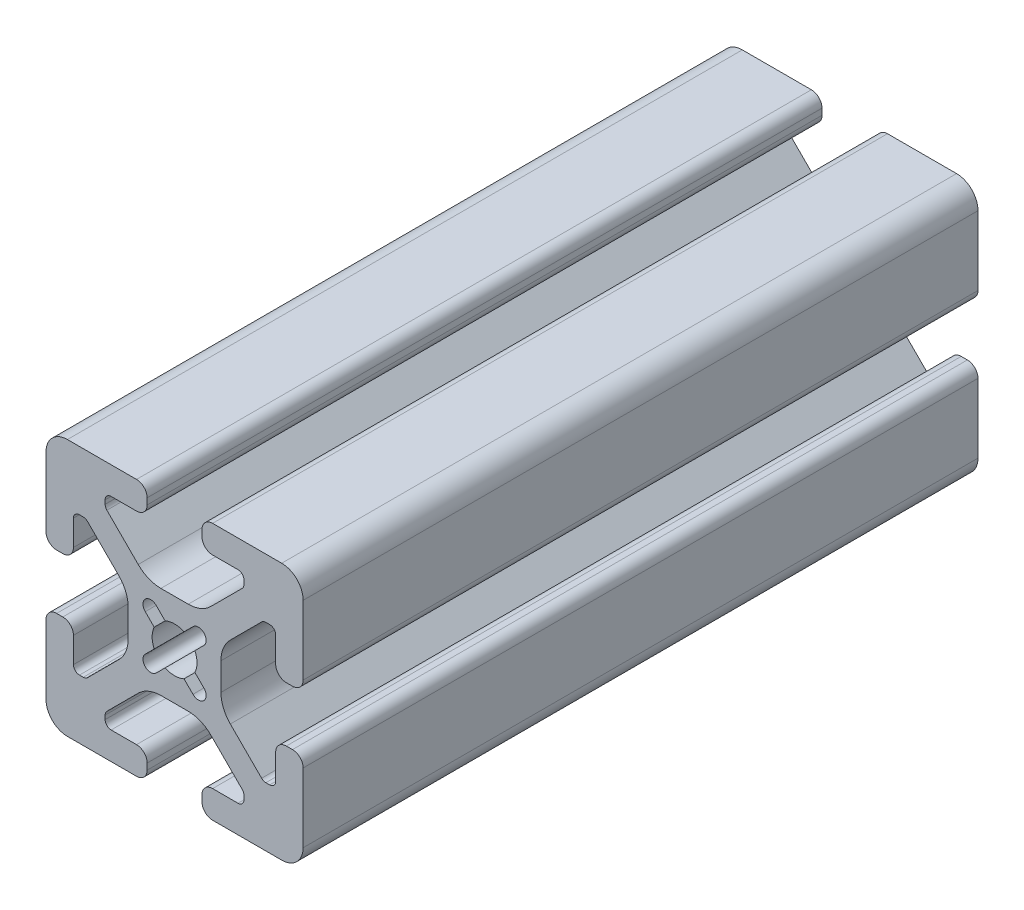
from build123d import *

# Parameters (mm, degrees)
EXTRUDE1_DEPTH = 100


with BuildPart() as part:
    # Sketch1 → Extrude1 (new body)
    with BuildSketch(Plane.XY):
        with BuildLine():
            Line((14.986, -5.6388), (14.986, -9.398))
            ThreePointArc((14.986, -9.398), (14.725617928, -10.026617928), (14.097, -10.287))
            Line((14.097, -10.287), (13.528917816, -10.287))
            ThreePointArc((13.528917816, -10.287), (13.188712244, -10.219328904), (12.900299887, -10.026617928))
            Line((12.900299887, -10.026617928), (8.260840349, -5.38715839))
            ThreePointArc((8.260840349, -5.38715839), (7.231213135, -3.846212368), (6.869656138, -2.028542601))
            Line((6.869656138, -2.028542601), (6.869656138, 2.028542601))
            ThreePointArc((6.869656138, 2.028542601), (7.231213135, 3.846212368), (8.260840349, 5.38715839))
            Line((8.260840349, 5.38715839), (12.900299887, 10.026617929))
            ThreePointArc((12.900299887, 10.026617929), (13.188712244, 10.219328904), (13.528917816, 10.287))
            Line((13.528917816, 10.287), (14.097, 10.287))
            ThreePointArc((14.097, 10.287), (14.725617928, 10.026617929), (14.986, 9.398))
            Line((14.986, 9.398), (14.986, 5.6388))
            ThreePointArc((14.986, 5.6388), (15.447248241, 4.525248241), (16.5608, 4.064))
            Line((16.5608, 4.064), (17.4752, 4.064))
            ThreePointArc((17.4752, 4.064), (18.588751759, 4.525248241), (19.05, 5.6388))
            Line((19.05, 5.6388), (19.05, 15.875))
            ThreePointArc((19.05, 15.875), (18.12006403, 18.12006403), (15.875, 19.05))
            Line((15.875, 19.05), (5.6388, 19.05))
            ThreePointArc((5.6388, 19.05), (4.525248241, 18.588751759), (4.064, 17.4752))
            Line((4.064, 17.4752), (4.064, 16.5608))
            ThreePointArc((4.064, 16.5608), (4.525248241, 15.447248241), (5.6388, 14.986))
            Line((5.6388, 14.986), (9.398, 14.986))
            ThreePointArc((9.398, 14.986), (10.026617928, 14.725617928), (10.287, 14.097))
            Line((10.287, 14.097), (10.287, 13.528917816))
            ThreePointArc((10.287, 13.528917816), (10.219328904, 13.188712244), (10.026617928, 12.900299887))
            Line((10.026617928, 12.900299887), (5.38715839, 8.260840349))
            ThreePointArc((5.38715839, 8.260840349), (3.846212368, 7.231213135), (2.028542601, 6.869656138))
            Line((2.028542601, 6.869656138), (-2.028542601, 6.869656138))
            ThreePointArc((-2.028542601, 6.869656138), (-3.846212368, 7.231213135), (-5.38715839, 8.260840349))
            Line((-5.38715839, 8.260840349), (-10.026617929, 12.900299887))
            ThreePointArc((-10.026617929, 12.900299887), (-10.219328904, 13.188712244), (-10.287, 13.528917816))
            Line((-10.287, 13.528917816), (-10.287, 14.097))
            ThreePointArc((-10.287, 14.097), (-10.026617929, 14.725617928), (-9.398, 14.986))
            Line((-9.398, 14.986), (-5.6388, 14.986))
            ThreePointArc((-5.6388, 14.986), (-4.525248241, 15.447248241), (-4.064, 16.5608))
            Line((-4.064, 16.5608), (-4.064, 17.4752))
            ThreePointArc((-4.064, 17.4752), (-4.525248241, 18.588751759), (-5.6388, 19.05))
            Line((-5.6388, 19.05), (-15.875, 19.05))
            ThreePointArc((-15.875, 19.05), (-18.12006403, 18.12006403), (-19.05, 15.875))
            Line((-19.05, 15.875), (-19.05, 5.6388))
            ThreePointArc((-19.05, 5.6388), (-18.588751759, 4.525248241), (-17.4752, 4.064))
            Line((-17.4752, 4.064), (-16.5608, 4.064))
            ThreePointArc((-16.5608, 4.064), (-15.447248241, 4.525248241), (-14.986, 5.6388))
            Line((-14.986, 5.6388), (-14.986, 9.398))
            ThreePointArc((-14.986, 9.398), (-14.725617929, 10.026617928), (-14.097, 10.287))
            Line((-14.097, 10.287), (-13.528917816, 10.287))
            ThreePointArc((-13.528917816, 10.287), (-13.188712244, 10.219328904), (-12.900299887, 10.026617928))
            Line((-12.900299887, 10.026617928), (-8.260840349, 5.38715839))
            ThreePointArc((-8.260840349, 5.38715839), (-7.231213135, 3.846212368), (-6.869656138, 2.028542601))
            Line((-6.869656138, 2.028542601), (-6.869656138, -2.028542601))
            ThreePointArc((-6.869656138, -2.028542601), (-7.231213135, -3.846212368), (-8.260840349, -5.38715839))
            Line((-8.260840349, -5.38715839), (-12.900299887, -10.026617928))
            ThreePointArc((-12.900299887, -10.026617928), (-13.188712244, -10.219328904), (-13.528917816, -10.287))
            Line((-13.528917816, -10.287), (-14.097, -10.287))
            ThreePointArc((-14.097, -10.287), (-14.725617928, -10.026617928), (-14.986, -9.398))
            Line((-14.986, -9.398), (-14.986, -5.6388))
            ThreePointArc((-14.986, -5.6388), (-15.447248241, -4.525248241), (-16.5608, -4.064))
            Line((-16.5608, -4.064), (-17.4752, -4.064))
            ThreePointArc((-17.4752, -4.064), (-18.588751759, -4.525248241), (-19.05, -5.6388))
            Line((-19.05, -5.6388), (-19.05, -15.875))
            ThreePointArc((-19.05, -15.875), (-18.12006403, -18.12006403), (-15.875, -19.05))
            Line((-15.875, -19.05), (-5.6388, -19.05))
            ThreePointArc((-5.6388, -19.05), (-4.525248241, -18.588751759), (-4.064, -17.4752))
            Line((-4.064, -17.4752), (-4.064, -16.5608))
            ThreePointArc((-4.064, -16.5608), (-4.525248241, -15.447248241), (-5.6388, -14.986))
            Line((-5.6388, -14.986), (-9.398, -14.986))
            ThreePointArc((-9.398, -14.986), (-10.026617928, -14.725617928), (-10.287, -14.097))
            Line((-10.287, -14.097), (-10.287, -13.528917816))
            ThreePointArc((-10.287, -13.528917816), (-10.219328904, -13.188712244), (-10.026617928, -12.900299887))
            Line((-10.026617928, -12.900299887), (-5.38715839, -8.260840349))
            ThreePointArc((-5.38715839, -8.260840349), (-3.846212368, -7.231213135), (-2.028542601, -6.869656138))
            Line((-2.028542601, -6.869656138), (2.028542601, -6.869656138))
            ThreePointArc((2.028542601, -6.869656138), (3.846212368, -7.231213135), (5.38715839, -8.260840349))
            Line((5.38715839, -8.260840349), (10.026617928, -12.900299887))
            ThreePointArc((10.026617928, -12.900299887), (10.219328904, -13.188712244), (10.287, -13.528917816))
            Line((10.287, -13.528917816), (10.287, -14.097))
            ThreePointArc((10.287, -14.097), (10.026617928, -14.725617928), (9.398, -14.986))
            Line((9.398, -14.986), (5.6388, -14.986))
            ThreePointArc((5.6388, -14.986), (4.525248241, -15.447248241), (4.064, -16.5608))
            Line((4.064, -16.5608), (4.064, -17.4752))
            ThreePointArc((4.064, -17.4752), (4.525248241, -18.588751759), (5.6388, -19.05))
            Line((5.6388, -19.05), (15.875, -19.05))
            ThreePointArc((15.875, -19.05), (18.12006403, -18.12006403), (19.05, -15.875))
            Line((19.05, -15.875), (19.05, -5.6388))
            ThreePointArc((19.05, -5.6388), (18.588751759, -4.525248241), (17.4752, -4.064))
            Line((17.4752, -4.064), (16.5608, -4.064))
            ThreePointArc((16.5608, -4.064), (15.447248241, -4.525248241), (14.986, -5.6388))
        make_face()
        with BuildLine():
            Line((4.24561082, 2.639761197), (3.01775857, 1.401686117))
            ThreePointArc((3.01775857, 1.401686117), (3.327399997, 0.000140662), (3.017877069, -1.401430967))
            Line((3.017877069, -1.401430967), (4.343300873, -2.726854771))
            ThreePointArc((4.343300873, -2.726854771), (4.343300873, -4.343300873), (2.726854771, -4.343300873))
            Line((2.726854771, -4.343300873), (1.401430967, -3.017877069))
            ThreePointArc((1.401430967, -3.017877069), (0, -3.3274), (-1.401430967, -3.017877069))
            Line((-1.401430967, -3.017877069), (-2.726854771, -4.343300873))
            ThreePointArc((-2.726854771, -4.343300873), (-4.343300873, -4.343300873), (-4.343300873, -2.726854771))
            Line((-4.343300873, -2.726854771), (-3.017877069, -1.401430967))
            ThreePointArc((-3.017877069, -1.401430967), (-3.3274, 0), (-3.017877069, 1.401430967))
            Line((-3.017877069, 1.401430967), (-4.343300873, 2.726854771))
            ThreePointArc((-4.343300873, 2.726854771), (-4.343300873, 4.343300873), (-2.726854771, 4.343300873))
            Line((-2.726854771, 4.343300873), (-1.401430967, 3.017877069))
            ThreePointArc((-1.401430967, 3.017877069), (0.000140662, 3.327399997), (1.401686117, 3.01775857))
            Line((1.401686117, 3.01775857), (2.639761197, 4.24561082))
            ThreePointArc((2.639761197, 4.24561082), (4.343300873, 4.343300873), (4.24561082, 2.639761197))
        make_face(mode=Mode.SUBTRACT)
    extrude(amount=-EXTRUDE1_DEPTH)


solid = part.part
